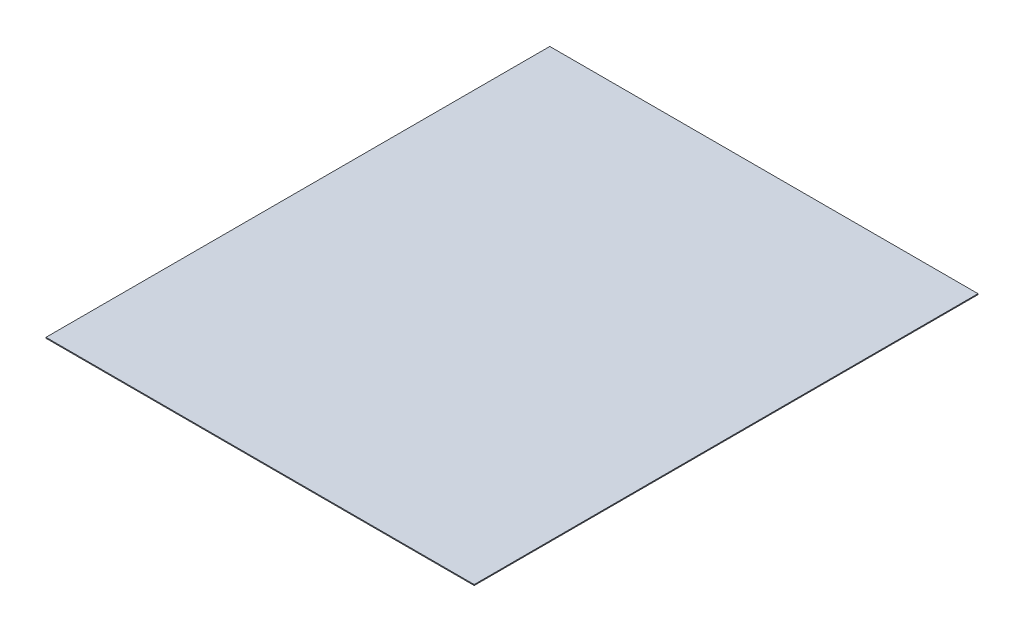
from build123d import *

# Parameters (mm, degrees)
SKETCH1_W               = 697
SKETCH1_H               = 1.5
TOPPING_DIS_UST_1_DEPTH = 820


with BuildPart() as part:
    # Sketch1 → TOPPING_dis_ust_1 (new body)
    with BuildSketch(Plane.XY):
        with Locations((350, 1969.25)):
            Rectangle(SKETCH1_W, SKETCH1_H)
    extrude(amount=-TOPPING_DIS_UST_1_DEPTH)


solid = part.part
